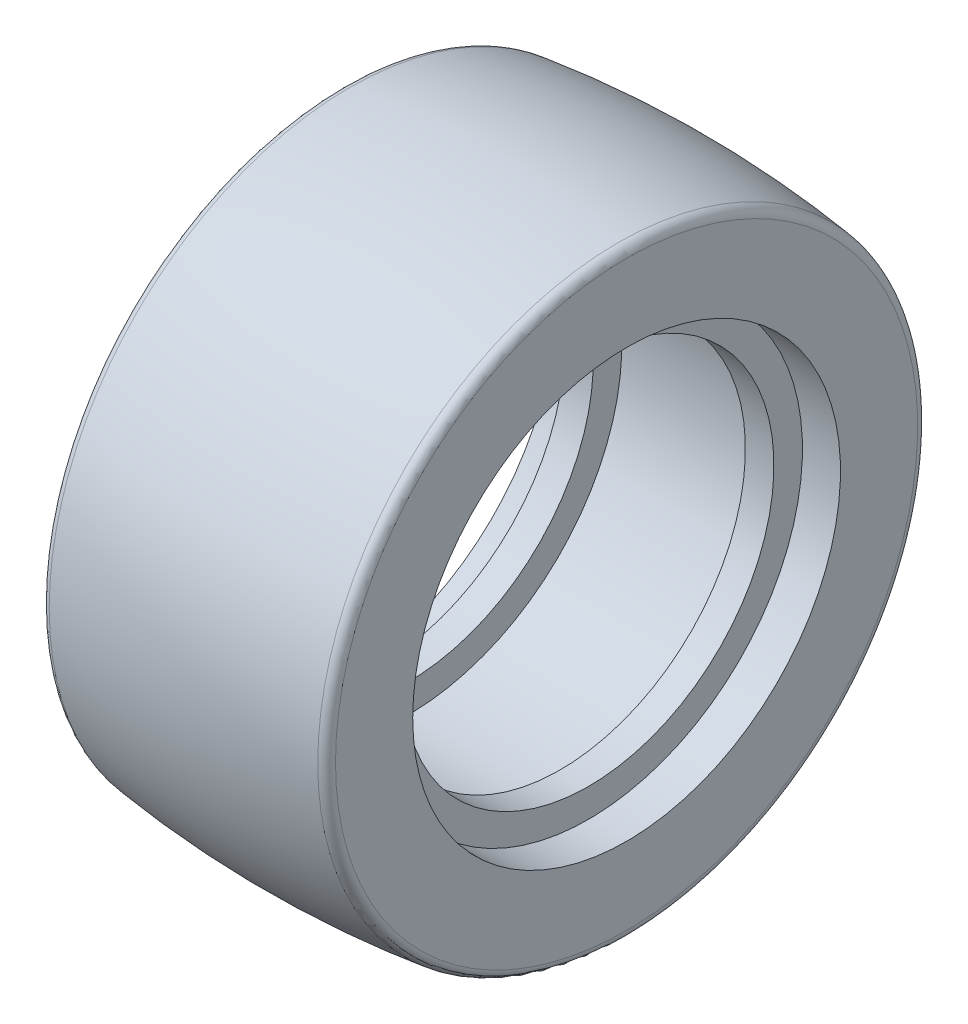
from build123d import *

# Parameters (mm, degrees)
FILLET_1_R = 1


with BuildPart() as part:
    # Эскиз1 → Повернуть1 (revolve)
    with BuildSketch(Plane.XY, mode=Mode.PRIVATE) as revolve_1_sk:
        with BuildLine():
            ThreePointArc((-15, 31.5), (0, 32.5), (15, 31.5))
            Line((15, 31.5), (15, 22.5))
            Line((15, 22.5), (11, 22.5))
            Line((11, 22.5), (11, 19.5))
            Line((11, 19.5), (8, 19.5))
            Line((8, 19.5), (8, 22.5))
            Line((8, 22.5), (-8, 22.5))
            Line((-8, 22.5), (-8, 19.5))
            Line((-8, 19.5), (-11, 19.5))
            Line((-11, 19.5), (-11, 22.5))
            Line((-11, 22.5), (-15, 22.5))
            Line((-15, 22.5), (-15, 31.5))
        make_face()
    revolve(revolve_1_sk.sketch.rotate(Axis((-27.729022135, 0, 0), (1, 0, 0)), 90), axis=Axis((-27.729022135, 0, 0), (1, 0, 0)))

    # Скругление1
    fillet_1_edges = [part.edges().sort_by_distance(p)[0] for p in [
        (15, 0, -31.5),
        (-15, 0, -31.5),
    ]]
    fillet(fillet_1_edges, radius=FILLET_1_R)


solid = part.part
